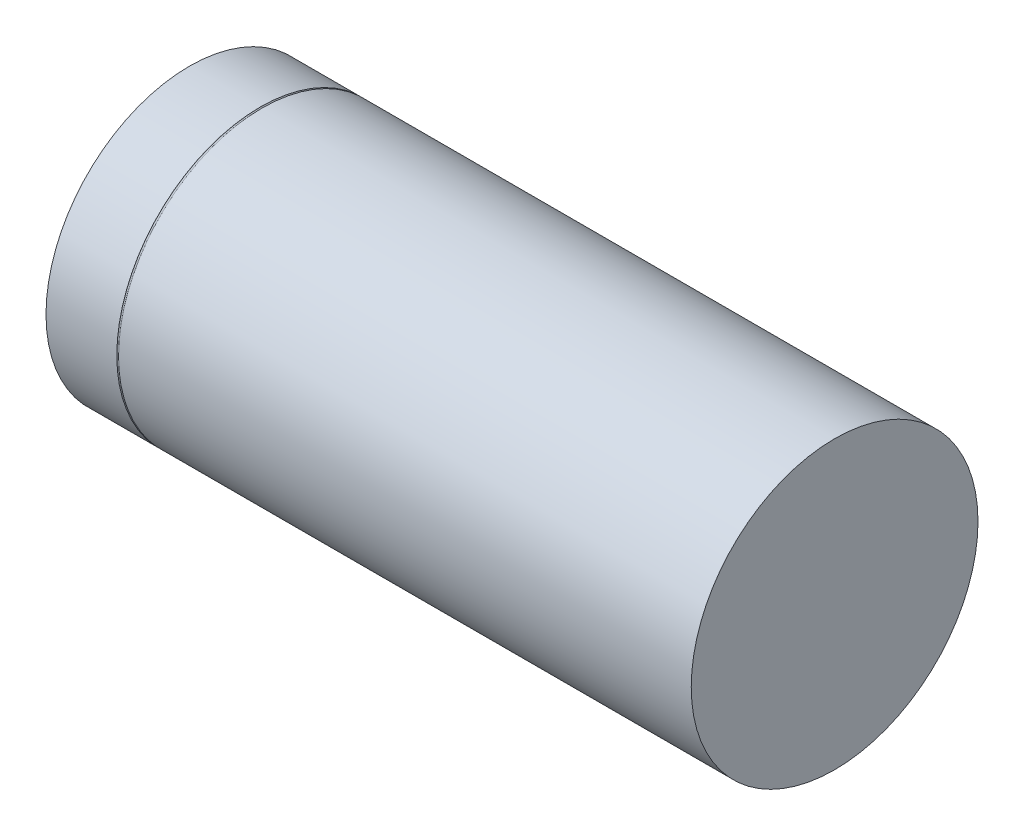
from build123d import *

# Parameters (mm, degrees)
SKETCH1_R           = 16
BOSS_EXTRUDE1_DEPTH = 72
SKETCH2_R           = 0.1


with BuildPart() as part:
    # Sketch1 → Boss-Extrude1 (new body)
    with BuildSketch(Plane(origin=(0, 0, 0), x_dir=(0, 0, -1), z_dir=(1, 0, 0))):
        Circle(SKETCH1_R)
    extrude(amount=BOSS_EXTRUDE1_DEPTH)

    # Sketch2 → Cut-Revolve1 (revolve, cut)
    with BuildSketch(Plane.XY, mode=Mode.PRIVATE) as cut_revolve1_sk:
        with Locations((8, 16)):
            Circle(SKETCH2_R)
    revolve(cut_revolve1_sk.sketch.rotate(Axis((72, 0, 0), (-1, 0, 0)), 90), axis=Axis((72, 0, 0), (-1, 0, 0)), mode=Mode.SUBTRACT)


solid = part.part
